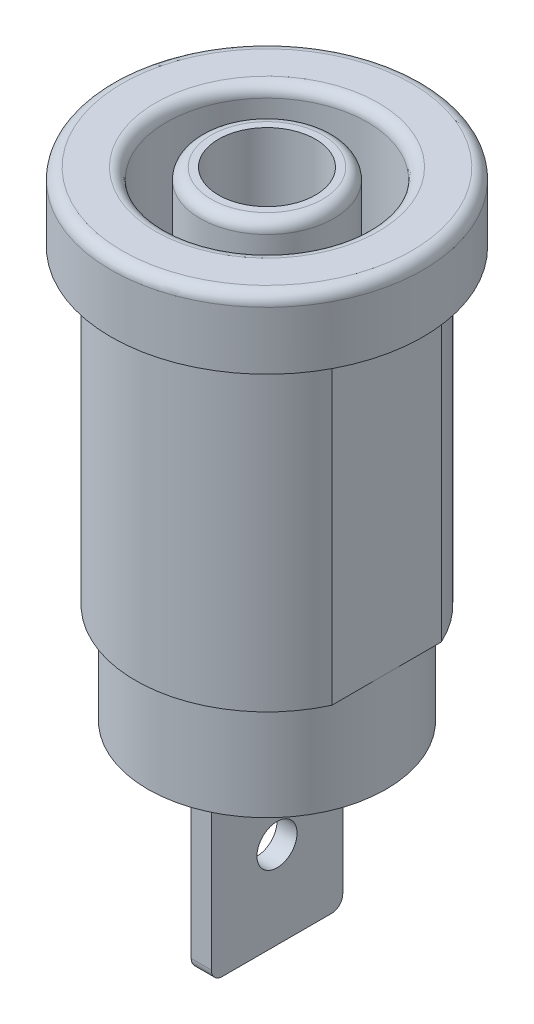
from build123d import *

# Parameters (mm, degrees)
SKETCH1_W           = 0.9
SKETCH1_H           = 5.9
BOSS_EXTRUDE1_DEPTH = 30
SKETCH1_3_R         = 3
SKETCH1_3_W         = 0.9
SKETCH1_3_H         = 5.9
BOSS_EXTRUDE2_DEPTH = 21.51
SKETCH1_4_R         = 5.35
SKETCH1_4_R_2       = 3
BOSS_EXTRUDE3_DEPTH = 21.5
SKETCH1_5_R         = 5.35
BOSS_EXTRUDE4_DEPTH = 17
SKETCH1_6_R         = 7
BOSS_EXTRUDE5_DEPTH = 3.1
SKETCH2_R           = 4.5
SKETCH2_R_2         = 3
CUT_EXTRUDE1_DEPTH  = 19.5
SKETCH3_R           = 2.175
CUT_EXTRUDE2_DEPTH  = 4.1
SKETCH4_R           = 2.1
CUT_EXTRUDE3_DEPTH  = 15.9
SKETCH5_R           = 0.9
CUT_EXTRUDE4_DEPTH  = 32.693887423
FILLET1_R           = 0.5


with BuildPart() as part:
    # Sketch1 → Boss-Extrude1 (new body)
    with BuildSketch(Plane(origin=(0, 0, 0), x_dir=(1, 0, 0), z_dir=(0, 1, 0))):
        Rectangle(SKETCH1_W, SKETCH1_H)
    extrude(amount=-BOSS_EXTRUDE1_DEPTH)

    # Sketch1<3> → Boss-Extrude2 (add)
    with BuildSketch(Plane(origin=(0, 0, 0), x_dir=(1, 0, 0), z_dir=(0, 1, 0))):
        Circle(SKETCH1_3_R)
        Rectangle(SKETCH1_3_W, SKETCH1_3_H, mode=Mode.SUBTRACT)
    extrude(amount=-BOSS_EXTRUDE2_DEPTH)

    # Sketch1<4> → Boss-Extrude3 (add)
    with BuildSketch(Plane(origin=(0, 0, 0), x_dir=(1, 0, 0), z_dir=(0, 1, 0))):
        Circle(SKETCH1_4_R)
        Circle(SKETCH1_4_R_2, mode=Mode.SUBTRACT)
    extrude(amount=-BOSS_EXTRUDE3_DEPTH)

    # Sketch1<5> → Boss-Extrude4 (add)
    with BuildSketch(Plane(origin=(0, 0, 0), x_dir=(1, 0, 0), z_dir=(0, 1, 0))):
        with BuildLine():
            ThreePointArc((-5.365, -2.454949083), (0, -5.9), (5.365, -2.454949083))
            Line((5.365, -2.454949083), (5.365, 2.454949083))
            ThreePointArc((5.365, 2.454949083), (0, 5.9), (-5.365, 2.454949083))
            Line((-5.365, 2.454949083), (-5.365, -2.454949083))
        make_face()
        Circle(SKETCH1_5_R, mode=Mode.SUBTRACT)
    extrude(amount=-BOSS_EXTRUDE4_DEPTH)

    # Sketch1<6> → Boss-Extrude5 (add)
    with BuildSketch(Plane(origin=(0, 0, 0), x_dir=(1, 0, 0), z_dir=(0, 1, 0))):
        Circle(SKETCH1_6_R)
        with BuildLine():
            ThreePointArc((5.365, -2.454949083), (0, -5.9), (-5.365, -2.454949083))
            Line((-5.365, -2.454949083), (-5.365, 2.454949083))
            ThreePointArc((-5.365, 2.454949083), (0, 5.9), (5.365, 2.454949083))
            Line((5.365, 2.454949083), (5.365, -2.454949083))
        make_face(mode=Mode.SUBTRACT)
    extrude(amount=-BOSS_EXTRUDE5_DEPTH)

    # Sketch2 → Cut-Extrude1 (cut)
    with BuildSketch(Plane(origin=(0, 0, 0), x_dir=(1, 0, 0), z_dir=(0, 1, 0))):
        Circle(SKETCH2_R)
        Circle(SKETCH2_R_2, mode=Mode.SUBTRACT)
    extrude(amount=-CUT_EXTRUDE1_DEPTH, mode=Mode.SUBTRACT)

    # Sketch3 → Cut-Extrude2 (cut)
    with BuildSketch(Plane(origin=(0, 0, 0), x_dir=(1, 0, 0), z_dir=(0, 1, 0))):
        Circle(SKETCH3_R)
    extrude(amount=-CUT_EXTRUDE2_DEPTH, mode=Mode.SUBTRACT)

    # Sketch4 → Cut-Extrude3 (cut)
    with BuildSketch(Plane(origin=(0, -4.1, 0), x_dir=(1, 0, 0), z_dir=(0, 1, 0))):
        Circle(SKETCH4_R)
    extrude(amount=-CUT_EXTRUDE3_DEPTH, mode=Mode.SUBTRACT)

    # Sketch5 → Cut-Extrude4 (cut, through all)
    with BuildSketch(Plane.ZY.offset(0.45)):
        with Locations((0, -26.1)):
            Circle(SKETCH5_R)
    extrude(amount=-CUT_EXTRUDE4_DEPTH, mode=Mode.SUBTRACT)

    # Fillet1
    fillet1_edges = [part.edges().sort_by_distance(p)[0] for p in [
        (-3, 0, 0),
        (-4.5, 0, 0),
        (-7, 0, 0),
        (0, -30, 2.95),
        (0, -30, -2.95),
    ]]
    fillet(fillet1_edges, radius=FILLET1_R)


solid = part.part
